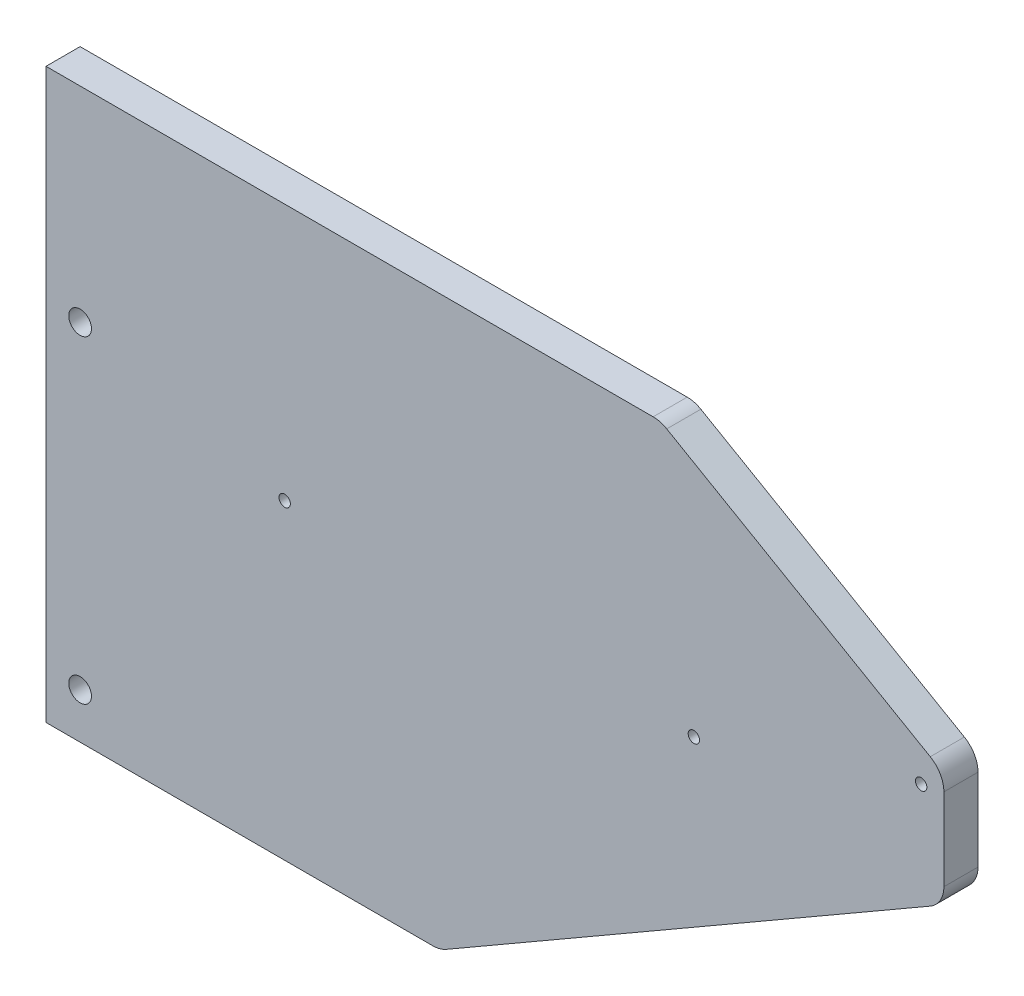
from build123d import *

# Parameters (mm, degrees)
SKIZZE1_R                       = 2.5
SKIZZE1_R_2                     = 5
AUFSATZ_LINEAR_AUSTRAGEN1_DEPTH = 7.5


with BuildPart() as part:
    # Skizze1 → Aufsatz-Linear austragen1 (new, symmetric)
    with BuildSketch(Plane.XY):
        with BuildLine():
            Line((-204.917893678, -153), (-375, -153))
            Line((-375, -153), (-375, 97))
            Line((-375, 97), (-107.923048454, 97))
            ThreePointArc((-107.923048454, 97), (-104.817219913, 96.591109915), (-101.923048454, 95.392304845))
            Line((-101.923048454, 95.392304845), (14, 28.464101615))
            ThreePointArc((14, 28.464101615), (18.392304845, 24.07179677), (20, 18.07179677))
            Line((20, 18.07179677), (20, 15))
            Line((20, 15), (20, -18.07179677))
            ThreePointArc((20, -18.07179677), (18.392304845, -24.07179677), (14, -28.464101615))
            Line((14, -28.464101615), (-198.917893678, -151.392304845))
            ThreePointArc((-198.917893678, -151.392304845), (-201.812065137, -152.591109915), (-204.917893678, -153))
        make_face()
        with Locations((-270, -16)):
            Circle(SKIZZE1_R, mode=Mode.SUBTRACT)
        with Locations((-360, 7)):
            Circle(SKIZZE1_R_2, mode=Mode.SUBTRACT)
        with Locations((-360, -133)):
            Circle(SKIZZE1_R_2, mode=Mode.SUBTRACT)
        with Locations((-90, -16)):
            Circle(SKIZZE1_R, mode=Mode.SUBTRACT)
        with Locations((10, 16)):
            Circle(SKIZZE1_R, mode=Mode.SUBTRACT)
    extrude(amount=AUFSATZ_LINEAR_AUSTRAGEN1_DEPTH, both=True)


solid = part.part
